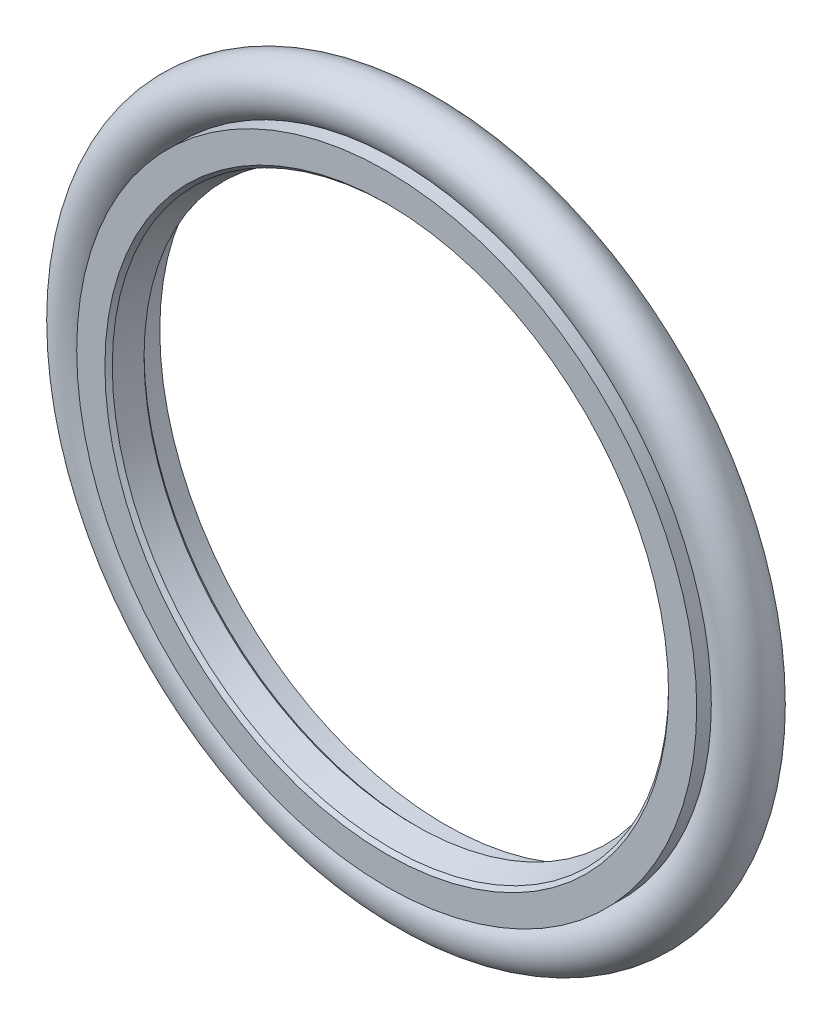
from build123d import *

# Parameters (mm, degrees)
SKETCH4_R = 1.765


with BuildPart() as part:
    # Sketch1 → Revolve1 (revolve)
    with BuildSketch(Plane(origin=(0, 0, 0), x_dir=(0, 0, -1), z_dir=(1, 0, 0)), mode=Mode.PRIVATE) as revolve1_sk:
        with BuildLine():
            Line((0, 19.25), (0, 20.9))
            Line((0, 20.9), (-3.95, 20.9))
            Line((-3.95, 20.9), (-3.95, 19))
            Line((-3.95, 19), (-3.7, 18.751398318))
            Line((-3.7, 18.751398318), (-2.06, 18.25))
            Line((-2.06, 18.25), (-1.81, 18.5))
            Line((-1.81, 18.5), (-1.81, 19))
            ThreePointArc((-1.81, 19), (-1.736776695, 19.176776695), (-1.56, 19.25))
            Line((-1.56, 19.25), (0, 19.25))
        make_face()
    revolve(revolve1_sk.sketch.rotate(Axis((0, 0, 0), (0, 0, 1)), 90), axis=Axis((0, 0, 0), (0, 0, 1)))


with BuildPart() as body_2:
    # Sketch4 → Revolve2 (revolve)
    with BuildSketch(Plane(origin=(0, 0, 0), x_dir=(0, 0, -1), z_dir=(1, 0, 0)), mode=Mode.PRIVATE) as revolve2_sk:
        with Locations((-1.975, 22.405)):
            Circle(SKETCH4_R)
    revolve(revolve2_sk.sketch.rotate(Axis((0, 0, 0), (0, 0, 1)), 90), axis=Axis((0, 0, 0), (0, 0, 1)))


solid = Compound([part.part, body_2.part])
